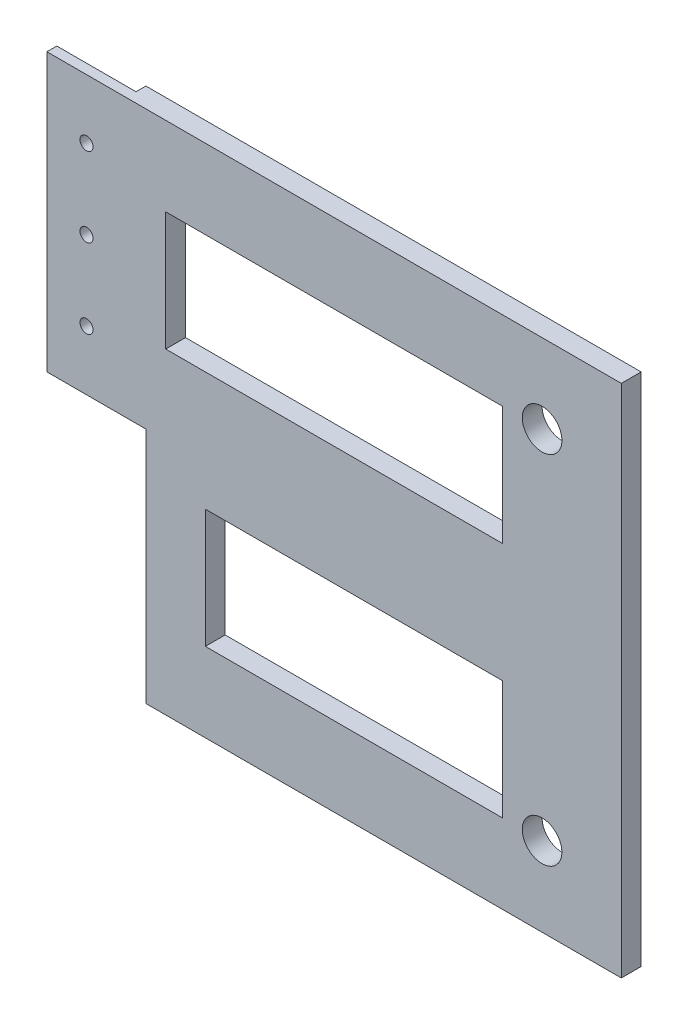
from build123d import *

# Parameters (mm, degrees)
BOSS_EXTRUDE1_DEPTH       = 6.35
SKETCH5_R                 = 6.35
CUT_EXTRUDE1_DEPTH        = 202.906036314
SKETCH6_W                 = 95.25
SKETCH6_H                 = 38.1
SKETCH6_W_2               = 107.95
CUT_EXTRUDE2_DEPTH        = 10.16
SKETCH7_W                 = 25.4
SKETCH7_H                 = 88.9
CUT_EXTRUDE3_DEPTH        = 3.175
M5X0_8_TAPPED_HOLE1_D     = 4.2
M5X0_8_TAPPED_HOLE1_DEPTH = 13.97
M5X0_8_TAPPED_HOLE1_TIP   = 1.2618073


with BuildPart() as part:
    # Sketch2 → Boss-Extrude1 (new body)
    with BuildSketch(Plane.XY):
        Polygon((184.15, -82.55), (184.15, 82.55), (0, 82.55), (0, -6.35), (31.75, -6.35), (31.75, -82.55), align=None)
    extrude(amount=BOSS_EXTRUDE1_DEPTH)

    # Sketch5 → Cut-Extrude1 (cut, through all)
    with BuildSketch(Plane.XY.offset(6.35)):
        with Locations((-158.75, 57.15)):
            Circle(SKETCH5_R)
        with Locations((-158.75, -57.15)):
            Circle(SKETCH5_R)
        with Locations((158.75, 57.15)):
            Circle(SKETCH5_R)
        with Locations((158.75, -57.15)):
            Circle(SKETCH5_R)
    extrude(amount=-CUT_EXTRUDE1_DEPTH, mode=Mode.SUBTRACT)

    # Sketch6 → Cut-Extrude2 (cut)
    with BuildSketch(Plane.XY.offset(6.35)):
        with Locations((98.425, -38.1)):
            Rectangle(SKETCH6_W, SKETCH6_H)
        with Locations((92.075, 38.1)):
            Rectangle(SKETCH6_W_2, SKETCH6_H)
    extrude(amount=-CUT_EXTRUDE2_DEPTH, mode=Mode.SUBTRACT)

    # Sketch7 → Cut-Extrude3 (cut)
    with BuildSketch(Plane(origin=(0, 0, 0), x_dir=(-1, 0, 0), z_dir=(0, 0, -1))):
        with Locations((-12.7, 38.1)):
            Rectangle(SKETCH7_W, SKETCH7_H)
    extrude(amount=-CUT_EXTRUDE3_DEPTH, mode=Mode.SUBTRACT)

    # M5x0.8 Tapped Hole1
    with Locations(Plane(origin=(0, 0, 3.175), x_dir=(-1, 0, 0), z_dir=(0, 0, -1))):
        with Locations((-12.7, 38.1), (-12.7, 63.5), (-12.7, 12.7), (-2.670853236, 86.574215023)):
            Hole(M5X0_8_TAPPED_HOLE1_D / 2, depth=M5X0_8_TAPPED_HOLE1_DEPTH)
            with Locations((0, 0, -(M5X0_8_TAPPED_HOLE1_DEPTH + M5X0_8_TAPPED_HOLE1_TIP / 2))):  # 118° drill point
                Cone(0, M5X0_8_TAPPED_HOLE1_D / 2, M5X0_8_TAPPED_HOLE1_TIP, mode=Mode.SUBTRACT)


solid = part.part
